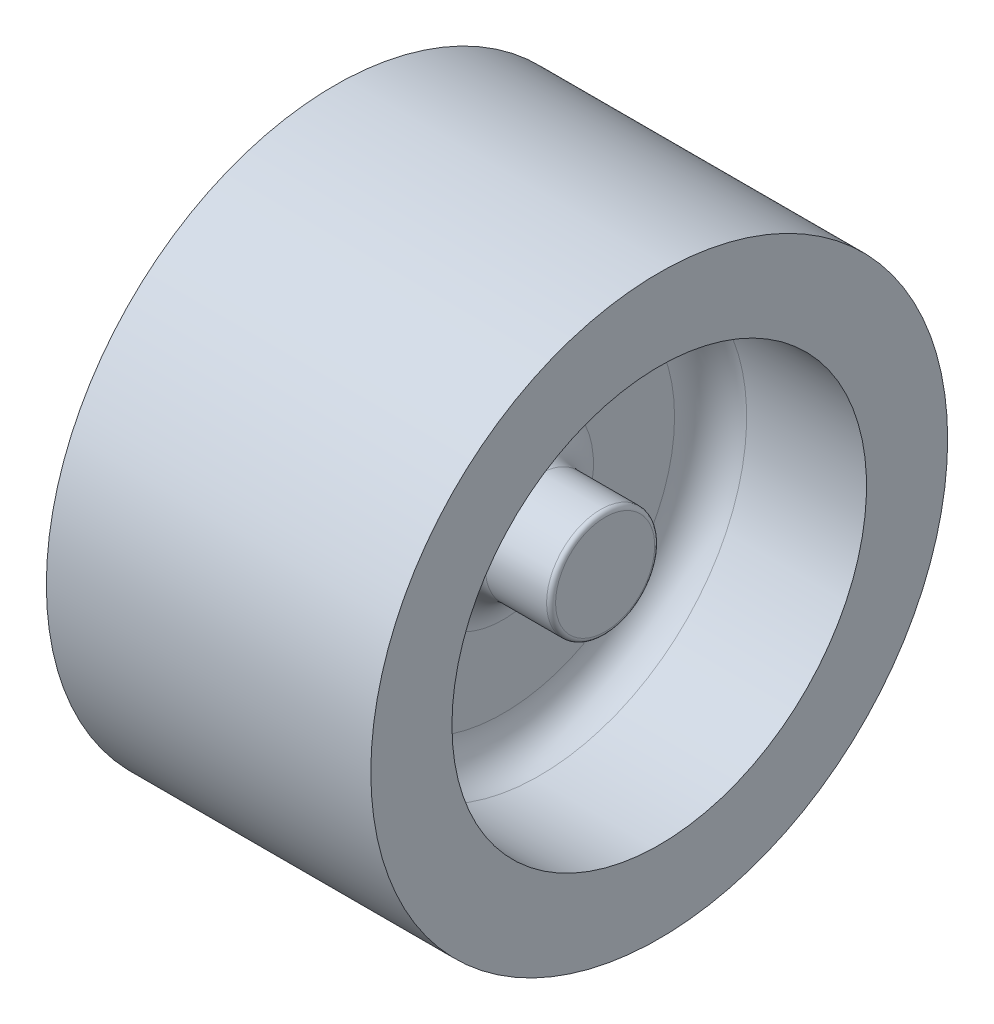
from build123d import *

# Parameters (mm, degrees)
SKETCH2_R          = 1.55
CUT_EXTRUDE1_DEPTH = 15


with BuildPart() as part:
    # Sketch1 → Revolve1 (revolve)
    with BuildSketch(Plane.XY, mode=Mode.PRIVATE) as revolve1_sk:
        with BuildLine():
            Line((14.647461996, 11.5), (14.647461996, 16))
            Line((14.647461996, 16), (-3.352538004, 16))
            Line((-3.352538004, 16), (-3.352538004, 14.25))
            Line((-3.352538004, 14.25), (11.147461996, 14.25))
            Line((11.147461996, 14.25), (11.147461996, 13))
            Line((11.147461996, 13), (4.397461996, 13))
            ThreePointArc((4.397461996, 13), (2.983248434, 12.414213562), (2.397461996, 11))
            Line((2.397461996, 11), (2.397461996, 5))
            ThreePointArc((2.397461996, 5), (2.324238692, 4.823223305), (2.147461996, 4.75))
            Line((2.147461996, 4.75), (0.647461996, 4.75))
            ThreePointArc((0.647461996, 4.75), (0.470685301, 4.676776695), (0.397461996, 4.5))
            Line((0.397461996, 4.5), (0.397461996, 3.375))
            ThreePointArc((0.397461996, 3.375), (0.324238692, 3.198223305), (0.147461996, 3.125))
            Line((0.147461996, 3.125), (-4.352538004, 3.125))
            Line((-4.352538004, 3.125), (-4.352538004, 0))
            Line((-4.352538004, 0), (11.647461996, 0))
            Line((11.647461996, 0), (11.647461996, 2.75))
            ThreePointArc((11.647461996, 2.75), (11.574238692, 2.926776695), (11.397461996, 3))
            Line((11.397461996, 3), (7.997461996, 3))
            ThreePointArc((7.997461996, 3), (6.583248434, 3.585786438), (5.997461996, 5))
            Line((5.997461996, 5), (5.997461996, 9.5))
            ThreePointArc((5.997461996, 9.5), (6.583248434, 10.914213562), (7.997461996, 11.5))
            Line((7.997461996, 11.5), (14.647461996, 11.5))
        make_face()
    revolve(revolve1_sk.sketch.rotate(Axis((0, 0, 0), (1, 0, 0)), 90), axis=Axis((0, 0, 0), (1, 0, 0)))

    # Sketch2 → Cut-Extrude1 (cut)
    with BuildSketch(Plane.ZY.offset(4.352538004)):
        Circle(SKETCH2_R)
    extrude(amount=-CUT_EXTRUDE1_DEPTH, mode=Mode.SUBTRACT)


solid = part.part
